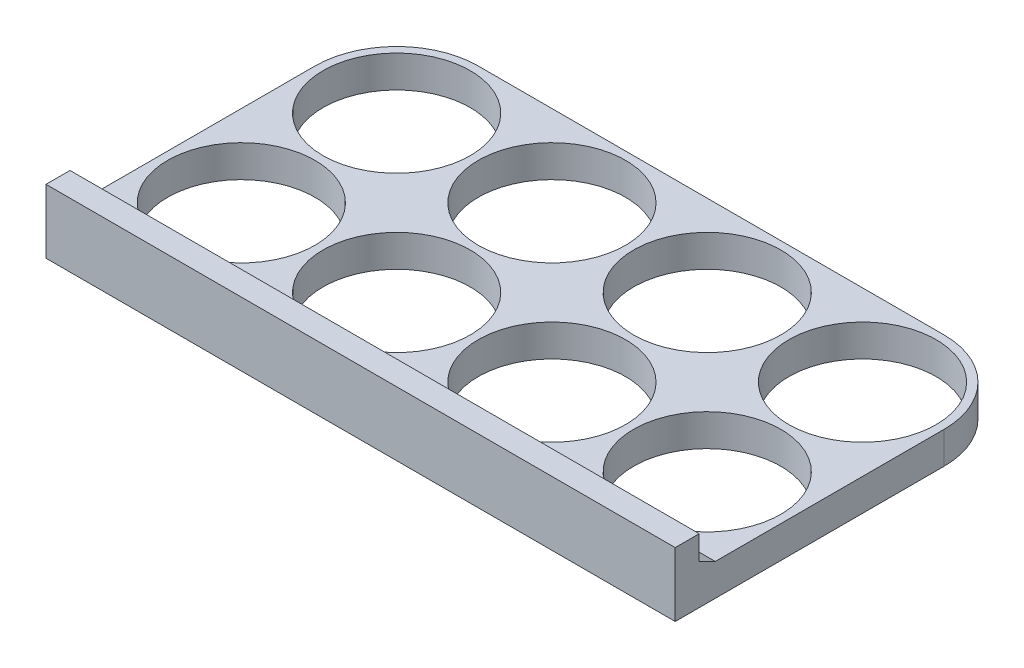
from build123d import *

# Parameters (mm, degrees)
SKETCH1_R           = 9.2
BOSS_EXTRUDE1_DEPTH = 4
SKETCH2_W           = 78.6
SKETCH2_H           = 3
BOSS_EXTRUDE2_DEPTH = 4
BOSS_EXTRUDE3_DEPTH = 39.3


with BuildPart() as part:
    # Sketch1 → Boss-Extrude1 (new body)
    with BuildSketch(Plane(origin=(0, 0, 0), x_dir=(1, 0, 0), z_dir=(0, 1, 0))):
        with BuildLine():
            Line((-10.2, 0), (-10.2, -14.2))
            Line((-10.2, -14.2), (68.4, -14.2))
            Line((68.4, -14.2), (68.4, 0))
            Line((68.4, 0), (68.4, 19.4))
            ThreePointArc((68.4, 19.4), (65.412489168, 26.612489168), (58.2, 29.6))
            Line((58.2, 29.6), (0, 29.6))
            ThreePointArc((0, 29.6), (-7.212489168, 26.612489168), (-10.2, 19.4))
            Line((-10.2, 19.4), (-10.2, 0))
        make_face()
        with Locations(Location((0, 0, 0), (0, 0, 270))):
            Circle(SKETCH1_R, mode=Mode.SUBTRACT)
        with Locations(Location((19.4, 0, 0), (0, 0, 270))):
            Circle(SKETCH1_R, mode=Mode.SUBTRACT)
        with Locations(Location((38.8, 0, 0), (0, 0, 270))):
            Circle(SKETCH1_R, mode=Mode.SUBTRACT)
        with Locations(Location((58.2, 0, 0), (0, 0, 270))):
            Circle(SKETCH1_R, mode=Mode.SUBTRACT)
        with Locations(Location((19.4, 19.4, 0), (0, 0, 270))):
            Circle(SKETCH1_R, mode=Mode.SUBTRACT)
        with Locations(Location((38.8, 19.4, 0), (0, 0, 270))):
            Circle(SKETCH1_R, mode=Mode.SUBTRACT)
        with Locations(Location((58.2, 19.4, 0), (0, 0, 270))):
            Circle(SKETCH1_R, mode=Mode.SUBTRACT)
        with Locations(Location((0, 19.4, 0), (0, 0, 270))):
            Circle(SKETCH1_R, mode=Mode.SUBTRACT)
    extrude(amount=BOSS_EXTRUDE1_DEPTH)

    # Sketch2 → Boss-Extrude2 (add)
    with BuildSketch(Plane(origin=(0, 4, 0), x_dir=(1, 0, 0), z_dir=(0, 1, 0))):
        with Locations((29.1, -12.7)):
            Rectangle(SKETCH2_W, SKETCH2_H)
    extrude(amount=BOSS_EXTRUDE2_DEPTH)

    # Sketch3 → Boss-Extrude3 (add, symmetric)
    with BuildSketch(Plane(origin=(29.1, 0, 0), x_dir=(0, 0, -1), z_dir=(1, 0, 0))):
        Polygon((-9.2, 4), (-11.2, 5), (-11.2, 4), align=None)
    extrude(amount=BOSS_EXTRUDE3_DEPTH, both=True)


solid = part.part
